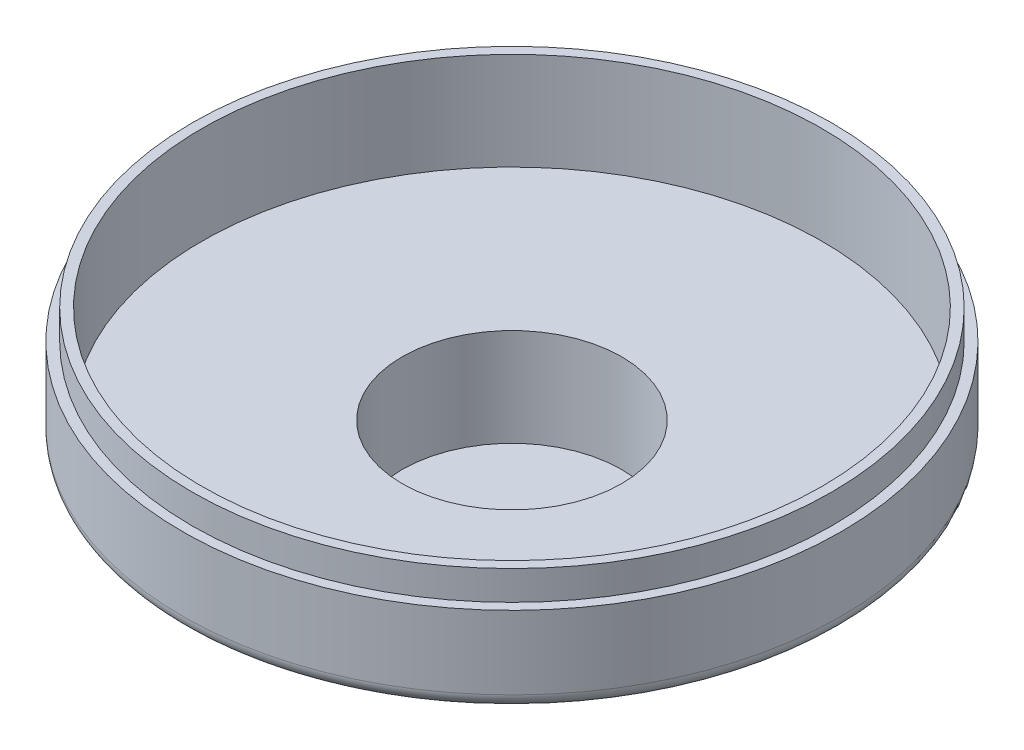
from build123d import *

# Parameters (mm, degrees)
FILLET1_R = 1.5


with BuildPart() as part:
    # Sketch1 → Revolve1 (revolve)
    with BuildSketch(Plane.XY):
        Polygon((33.75, 0), (33.75, -9), (13.25, -9), (13.25, -19), (0, -19), (0, -17), (11.25, -17), (11.25, -7), (31.75, -7), (31.75, 3), (32.75, 3), (32.75, 0), align=None)
    revolve(axis=Axis((0, -19, 0), (0, 1, 0)))

    # Fillet1
    fillet1_edges = [part.edges().sort_by_distance(p)[0] for p in [
        (-13.25, -19, 0),
        (-33.75, -9, 0),
    ]]
    fillet(fillet1_edges, radius=FILLET1_R)


solid = part.part
